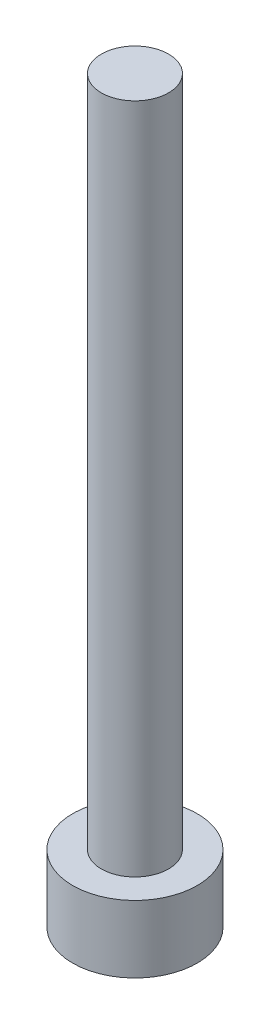
from build123d import *

# Parameters (mm, degrees)
SKETCH1_R           = 2.78
BOSS_EXTRUDE1_DEPTH = 3
SKETCH2_R           = 1.5
BOSS_EXTRUDE2_DEPTH = 30


with BuildPart() as part:
    # Sketch1 → Boss-Extrude1 (new body)
    with BuildSketch(Plane(origin=(0, 0, 0), x_dir=(1, 0, 0), z_dir=(0, 1, 0))):
        with Locations(Location((0, 0, 0), (0, 0, 270))):
            Circle(SKETCH1_R)
    extrude(amount=BOSS_EXTRUDE1_DEPTH)

    # Sketch2 → Boss-Extrude2 (add)
    with BuildSketch(Plane(origin=(0, 3, 0), x_dir=(1, 0, 0), z_dir=(0, 1, 0))):
        with Locations(Location((0, 0, 0), (0, 0, 270))):
            Circle(SKETCH2_R)
    extrude(amount=BOSS_EXTRUDE2_DEPTH)


solid = part.part
